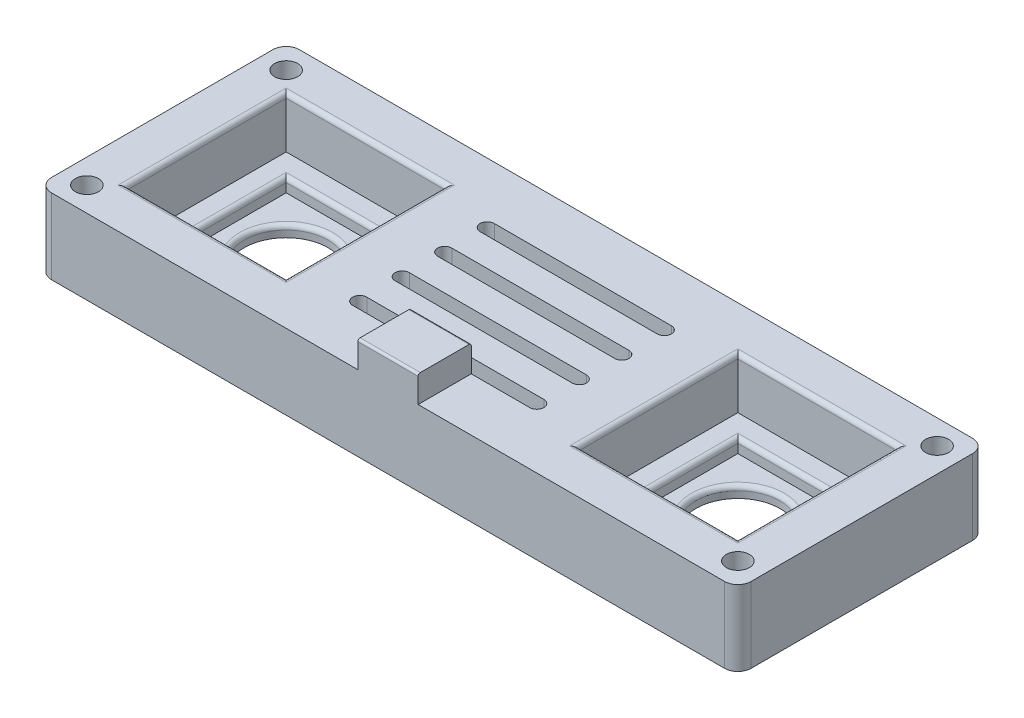
from build123d import *

# Parameters (mm, degrees)
SKETCH1_W           = 158
SKETCH1_H           = 56
BOSS_EXTRUDE1_DEPTH = 17
SKETCH8_W           = 13.6
SKETCH8_H           = 12
BOSS_EXTRUDE2_DEPTH = 6
SKETCH2_W           = 36
SKETCH2_H           = 36
CUT_EXTRUDE1_DEPTH  = 11.5
SKETCH3_W           = 26
SKETCH3_H           = 26
CUT_EXTRUDE2_DEPTH  = 3
CUT_EXTRUDE3_REACH  = 88.286
SKETCH4_R           = 9.5
SKETCH5_R           = 2.6
CUT_EXTRUDE4_DEPTH  = 4.5
CUT_EXTRUDE5_REACH  = 87.522
FILLET1_R           = 3
FILLET2_R           = 1
FILLET3_R           = 1
FILLET4_R           = 1
FILLET5_R           = 0.5


with BuildPart() as part:
    # Sketch1 → Boss-Extrude1 (new body)
    with BuildSketch(Plane(origin=(0, 0, 0), x_dir=(1, 0, 0), z_dir=(0, 1, 0))):
        Rectangle(SKETCH1_W, SKETCH1_H)
    extrude(amount=BOSS_EXTRUDE1_DEPTH)

    # Sketch8 → Boss-Extrude2 (add)
    with BuildSketch(Plane(origin=(0, 17, 0), x_dir=(1, 0, 0), z_dir=(0, 1, 0))):
        with Locations((0, -22)):
            Rectangle(SKETCH8_W, SKETCH8_H)
    extrude(amount=BOSS_EXTRUDE2_DEPTH)

    # Sketch2 → Cut-Extrude1 (cut)
    with BuildSketch(Plane(origin=(0, 17, 0), x_dir=(1, 0, 0), z_dir=(0, 1, 0))):
        with Locations((-51, 0)):
            Rectangle(SKETCH2_W, SKETCH2_H)
        with Locations((51, 0)):
            Rectangle(SKETCH2_W, SKETCH2_H)
    extrude(amount=-CUT_EXTRUDE1_DEPTH, mode=Mode.SUBTRACT)

    # Sketch3 → Cut-Extrude2 (cut)
    with BuildSketch(Plane(origin=(0, 5.5, 0), x_dir=(1, 0, 0), z_dir=(0, 1, 0))):
        with Locations((51, 0)):
            Rectangle(SKETCH3_W, SKETCH3_H)
        with Locations((-51, 0)):
            Rectangle(SKETCH3_W, SKETCH3_H)
    extrude(amount=-CUT_EXTRUDE2_DEPTH, mode=Mode.SUBTRACT)

    # Sketch4 → Cut-Extrude3 (cut, up to next)
    with BuildSketch(Plane(origin=(0, 2.5, 0), x_dir=(1, 0, 0), z_dir=(0, 1, 0)), mode=Mode.PRIVATE) as cut_extrude3_sk1:
        with Locations(Location((-51, 0, 0), (0, 0, 270))):
            Circle(SKETCH4_R)
    cut_extrude3_tool1 = extrude(cut_extrude3_sk1.sketch, amount=-CUT_EXTRUDE3_REACH, mode=Mode.PRIVATE) & part.part
    # Sketch4 → Cut-Extrude3 (cut, up to next)
    with BuildSketch(Plane(origin=(0, 2.5, 0), x_dir=(1, 0, 0), z_dir=(0, 1, 0)), mode=Mode.PRIVATE) as cut_extrude3_sk2:
        with Locations(Location((51, 0, 0), (0, 0, 270))):
            Circle(SKETCH4_R)
    cut_extrude3_tool2 = extrude(cut_extrude3_sk2.sketch, amount=-CUT_EXTRUDE3_REACH, mode=Mode.PRIVATE) & part.part
    add(cut_extrude3_tool1.solids().sort_by_distance((-51, 2.5, 0))[0], mode=Mode.SUBTRACT)
    add(cut_extrude3_tool2.solids().sort_by_distance((51, 2.5, 0))[0], mode=Mode.SUBTRACT)

    # Sketch5 → Cut-Extrude4 (cut)
    with BuildSketch(Plane(origin=(0, 17, 0), x_dir=(1, 0, 0), z_dir=(0, 1, 0))):
        with Locations(Location((-73.5, 22.5, 0), (0, 0, 270))):
            Circle(SKETCH5_R)
        with Locations(Location((73.5, 22.5, 0), (0, 0, 90))):
            Circle(SKETCH5_R)
        with Locations(Location((73.5, -22.5, 0), (0, 0, 270))):
            Circle(SKETCH5_R)
        with Locations(Location((-73.5, -22.5, 0), (0, 0, 90))):
            Circle(SKETCH5_R)
    extrude(amount=-CUT_EXTRUDE4_DEPTH, mode=Mode.SUBTRACT)

    # Sketch6 → Cut-Extrude5 (cut, up to next)
    with BuildSketch(Plane(origin=(0, 17, 0), x_dir=(1, 0, 0), z_dir=(0, 1, 0)), mode=Mode.PRIVATE) as cut_extrude5_sk1:
        with BuildLine():
            Line((-20, 6.4), (20, 6.4))
            ThreePointArc((20, 6.4), (21.6, 4.8), (20, 3.2))
            Line((20, 3.2), (-20, 3.2))
            ThreePointArc((-20, 3.2), (-21.6, 4.8), (-20, 6.4))
        make_face()
    cut_extrude5_tool1 = extrude(cut_extrude5_sk1.sketch, amount=-CUT_EXTRUDE5_REACH, mode=Mode.PRIVATE) & part.part
    # Sketch6 → Cut-Extrude5 (cut, up to next)
    with BuildSketch(Plane(origin=(0, 17, 0), x_dir=(1, 0, 0), z_dir=(0, 1, 0)), mode=Mode.PRIVATE) as cut_extrude5_sk2:
        with BuildLine():
            Line((-20, 16), (20, 16))
            ThreePointArc((20, 16), (21.6, 14.4), (20, 12.8))
            Line((20, 12.8), (-20, 12.8))
            ThreePointArc((-20, 12.8), (-21.6, 14.4), (-20, 16))
        make_face()
    cut_extrude5_tool2 = extrude(cut_extrude5_sk2.sketch, amount=-CUT_EXTRUDE5_REACH, mode=Mode.PRIVATE) & part.part
    # Sketch6 → Cut-Extrude5 (cut, up to next)
    with BuildSketch(Plane(origin=(0, 17, 0), x_dir=(1, 0, 0), z_dir=(0, 1, 0)), mode=Mode.PRIVATE) as cut_extrude5_sk3:
        with BuildLine():
            Line((-20, -6.4), (20, -6.4))
            ThreePointArc((20, -6.4), (21.6, -4.8), (20, -3.2))
            Line((20, -3.2), (-20, -3.2))
            ThreePointArc((-20, -3.2), (-21.6, -4.8), (-20, -6.4))
        make_face()
    cut_extrude5_tool3 = extrude(cut_extrude5_sk3.sketch, amount=-CUT_EXTRUDE5_REACH, mode=Mode.PRIVATE) & part.part
    # Sketch6 → Cut-Extrude5 (cut, up to next)
    with BuildSketch(Plane(origin=(0, 17, 0), x_dir=(1, 0, 0), z_dir=(0, 1, 0)), mode=Mode.PRIVATE) as cut_extrude5_sk4:
        with BuildLine():
            Line((-20, -16), (20, -16))
            ThreePointArc((20, -16), (21.6, -14.4), (20, -12.8))
            Line((20, -12.8), (-20, -12.8))
            ThreePointArc((-20, -12.8), (-21.6, -14.4), (-20, -16))
        make_face()
    cut_extrude5_tool4 = extrude(cut_extrude5_sk4.sketch, amount=-CUT_EXTRUDE5_REACH, mode=Mode.PRIVATE) & part.part
    add(cut_extrude5_tool1.solids().sort_by_distance((0, 17, -4.8))[0], mode=Mode.SUBTRACT)
    add(cut_extrude5_tool2.solids().sort_by_distance((0, 17, -14.4))[0], mode=Mode.SUBTRACT)
    add(cut_extrude5_tool3.solids().sort_by_distance((0, 17, 4.8))[0], mode=Mode.SUBTRACT)
    add(cut_extrude5_tool4.solids().sort_by_distance((0, 17, 14.4))[0], mode=Mode.SUBTRACT)

    # Fillet1
    fillet1_edges = [part.edges().sort_by_distance(p)[0] for p in [
        (79, 8.5, 28),
        (-79, 8.5, 28),
        (-79, 8.5, -28),
        (79, 8.5, -28),
    ]]
    fillet(fillet1_edges, radius=FILLET1_R)

    # Fillet2
    fillet2_edges = [part.edges().sort_by_distance(p)[0] for p in [
        (-51, 2.5, -9.5),
        (51, 2.5, -9.5),
    ]]
    fillet(fillet2_edges, radius=FILLET2_R)

    # Fillet3
    fillet3_edges = [part.edges().sort_by_distance(p)[0] for p in [
        (38, 5.5, 0),
        (51, 5.5, 13),
        (64, 5.5, 0),
        (51, 5.5, -13),
        (-51, 5.5, -13),
        (-64, 5.5, 0),
        (-51, 5.5, 13),
        (-38, 5.5, 0),
    ]]
    fillet(fillet3_edges, radius=FILLET3_R)

    # Fillet4
    fillet4_edges = [part.edges().sort_by_distance(p)[0] for p in [
        (-33, 17, 0),
        (-51, 17, -18),
        (-69, 17, 0),
        (-51, 17, 18),
        (69, 17, 0),
        (51, 17, -18),
        (33, 17, 0),
        (51, 17, 18),
    ]]
    fillet(fillet4_edges, radius=FILLET4_R)

    # Fillet5
    fillet5_edges = [part.edges().sort_by_distance(p)[0] for p in [
        (0, 23, 28),
        (0, 23, 16),
    ]]
    fillet(fillet5_edges, radius=FILLET5_R)


solid = part.part
